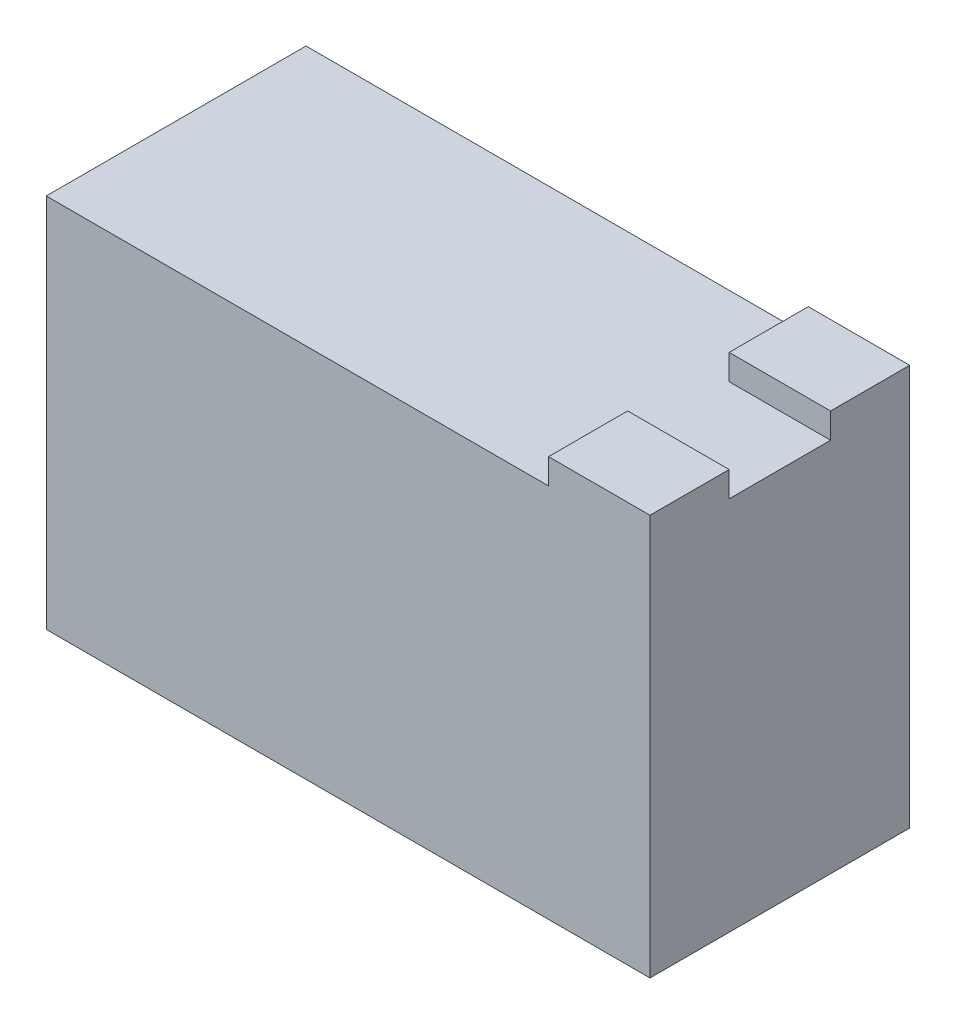
from build123d import *

# Parameters (mm, degrees)
SKETCH1_W           = 151.13
SKETCH1_H           = 65.024
BOSS_EXTRUDE1_DEPTH = 93.98
SKETCH2_W           = 25.4
SKETCH2_H           = 19.812
BOSS_EXTRUDE2_DEPTH = 6.35


with BuildPart() as part:
    # Sketch1 → Boss-Extrude1 (new body)
    with BuildSketch(Plane(origin=(0, 0, 0), x_dir=(1, 0, 0), z_dir=(0, 1, 0))):
        Rectangle(SKETCH1_W, SKETCH1_H)
    extrude(amount=BOSS_EXTRUDE1_DEPTH)

    # Sketch2 → Boss-Extrude2 (add)
    with BuildSketch(Plane(origin=(0, 93.98, 0), x_dir=(1, 0, 0), z_dir=(0, 1, 0))):
        with Locations((62.865, 22.606)):
            Rectangle(SKETCH2_W, SKETCH2_H)
        with Locations((62.865, -22.606)):
            Rectangle(SKETCH2_W, SKETCH2_H)
    extrude(amount=BOSS_EXTRUDE2_DEPTH)


solid = part.part
